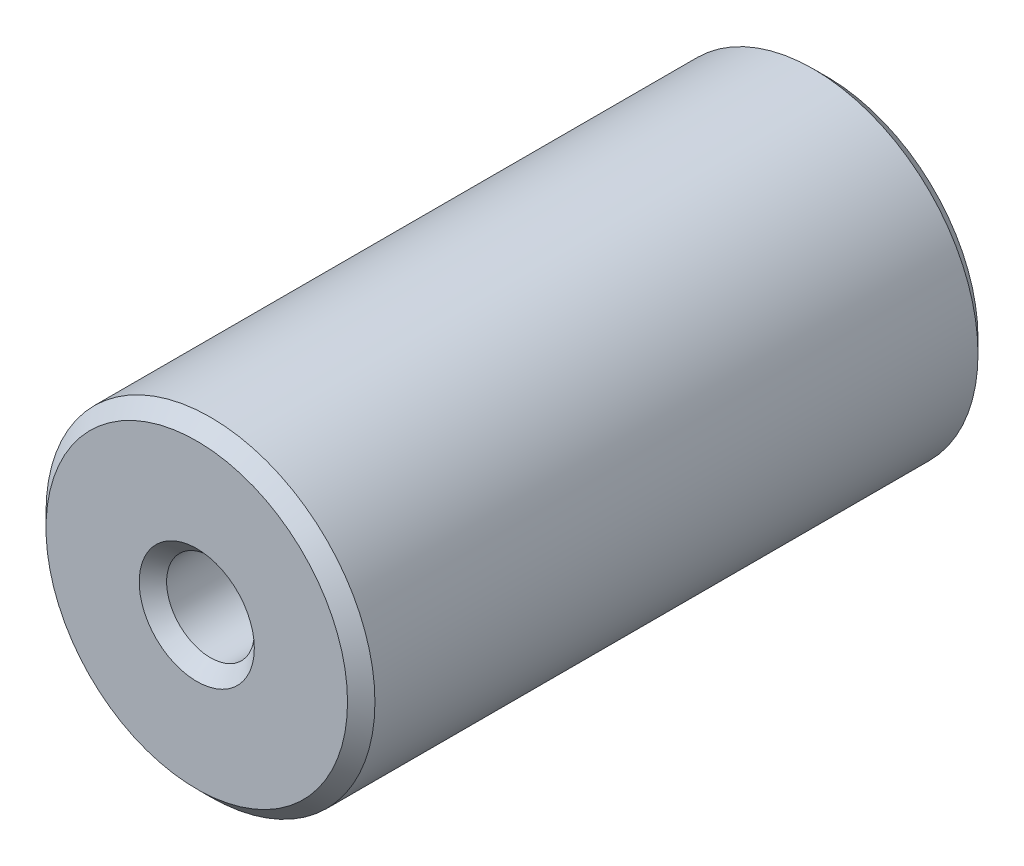
from build123d import *

# Parameters (mm, degrees)
ESQUISSE1_R        = 12
ESQUISSE1_R_2      = 3.2
BOSS_EXTRU_1_DEPTH = 46
CHANFREIN1_SIZE    = 1


with BuildPart() as part:
    # Esquisse1 → Boss.-Extru.1 (new body)
    with BuildSketch(Plane.XY):
        Circle(ESQUISSE1_R)
        Circle(ESQUISSE1_R_2, mode=Mode.SUBTRACT)
    extrude(amount=BOSS_EXTRU_1_DEPTH)

    # Chanfrein1
    chanfrein1_edges = [part.edges().sort_by_distance(p)[0] for p in [
        (-12, 0, 0),
        (-12, 0, 46),
        (-3.2, 0, 0),
        (-3.2, 0, 46),
    ]]
    chamfer(chanfrein1_edges, length=CHANFREIN1_SIZE)


solid = part.part
